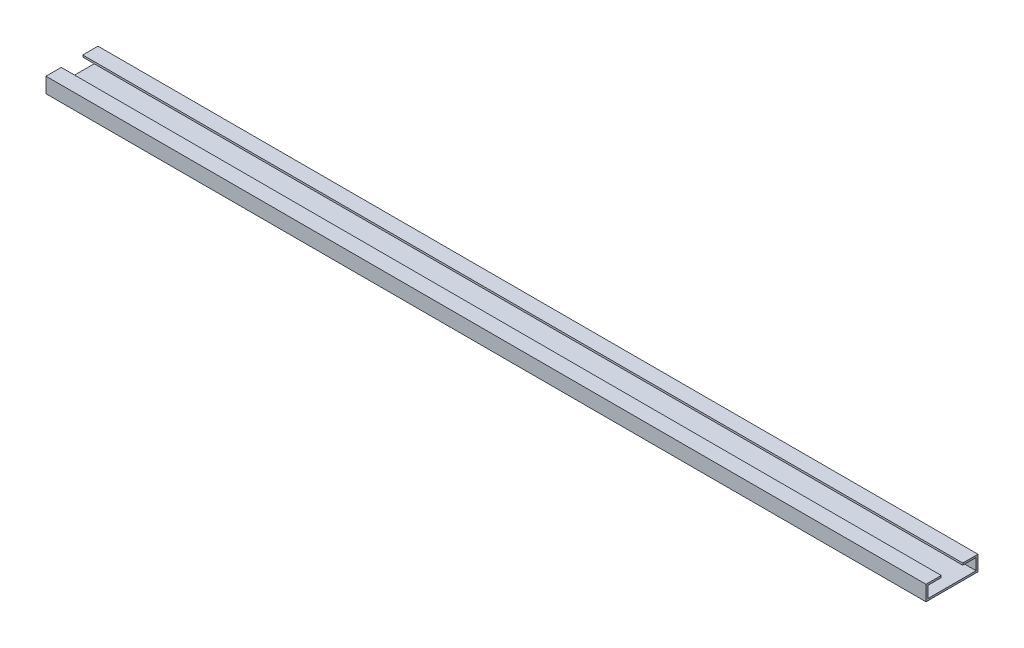
from build123d import *

# Parameters (mm, degrees)
Y_KSEKLIK_EKSTR_ZYON1_DEPTH      = 370
Y_KSEKLIK_EKSTR_ZYON2_DEPTH      = 2
Y_KSEKLIK_EKSTR_ZYON2_DEPTH_BACK = 141
KES_EKSTR_ZYON1_DEPTH            = 141


with BuildPart() as part:
    # Çizim1 → Yükseklik-Ekstrüzyon1 (new body)
    with BuildSketch(Plane(origin=(0, 0, 0), x_dir=(0, -1, 0), z_dir=(-1, 0, 0))):
        Polygon((0, 0), (-4, 0), (-4, -4), (-3.5, -4), (-3.5, -0.5), (-0.5, -0.5), (-0.5, -13.15), (-3.5, -13.15), (-3.5, -9.65), (-4, -9.65), (-4, -13.65), (0, -13.65), align=None)
    extrude(amount=-Y_KSEKLIK_EKSTR_ZYON1_DEPTH)

    # Çizim3 → Yükseklik-Ekstrüzyon2 (add, two sides: drawn at the far end of the back side and taken through both)
    with BuildSketch(Plane.ZY.offset(-Y_KSEKLIK_EKSTR_ZYON2_DEPTH_BACK)):
        Polygon((-13.65, 0), (-13.65, 4), (-9.65, 4), (-9.65, 3.5), (-13.15, 3.5), (-13.15, 0.5), (-0.5, 0.5), (-0.5, 3.5), (-4, 3.5), (-4, 4), (0, 4), (0, 0), align=None)
    extrude(amount=Y_KSEKLIK_EKSTR_ZYON2_DEPTH + Y_KSEKLIK_EKSTR_ZYON2_DEPTH_BACK)

    # Çizim5 → Kes-Ekstrüzyon1 (cut)
    with BuildSketch(Plane.ZY.offset(2)):
        Polygon((-13.65, 4), (-13.65, 0), (0, 0), (0, 4), (-4, 4), (-4, 3.5), (-0.5, 3.5), (-0.5, 0.5), (-13.15, 0.5), (-13.15, 3.5), (-9.65, 3.5), (-9.65, 4), align=None)
    extrude(amount=-KES_EKSTR_ZYON1_DEPTH, mode=Mode.SUBTRACT)


solid = part.part
